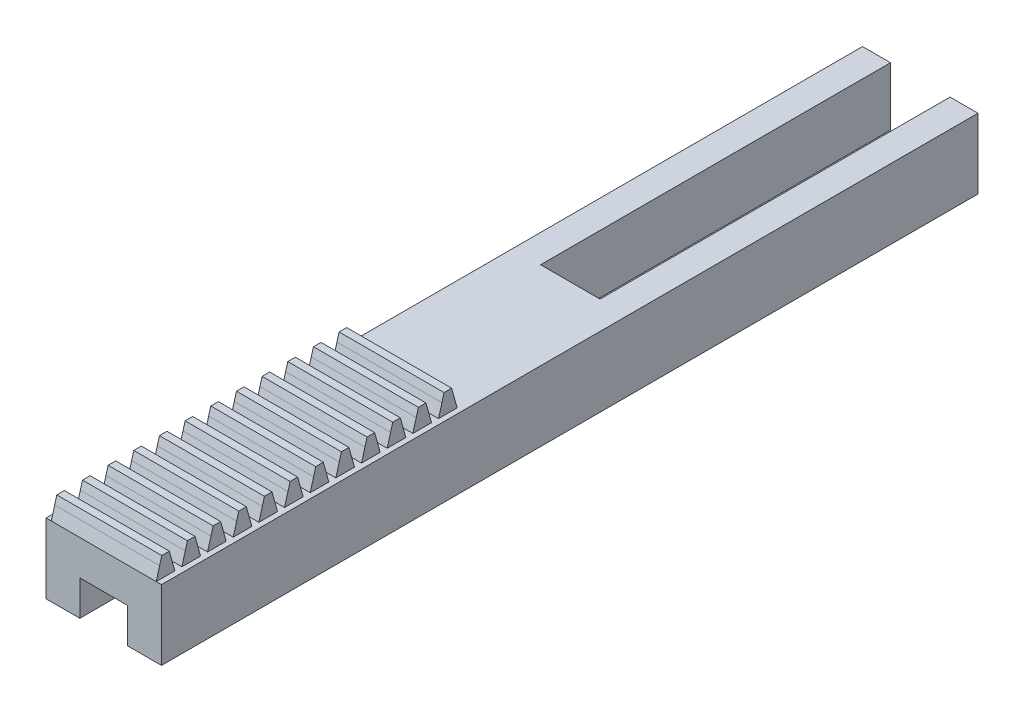
from build123d import *

# Parameters (mm, degrees)
EXTRUDE_2_DEPTH        = 4.95
EXTRUDE_3_DEPTH        = 4.5
PATTERN_LINEAR_1_COUNT = 12
PATTERN_LINEAR_1_PITCH = 2.2
SKETCH_7_W             = 5.1
SKETCH_7_H             = 30
CUT_EXTRUDE_1_DEPTH    = 5
SKETCH_3_W             = 35
SKETCH_3_H             = 3
CUT_EXTRUDE_2_DEPTH    = 2.05


with BuildPart() as part:
    # 스케치2 → 보스-돌출2 (new, symmetric)
    with BuildSketch(Plane(origin=(0, 0, 0), x_dir=(0, 0, -1), z_dir=(1, 0, 0))):
        Polygon((0, 6), (0, 0), (70, 0), (70, 6), (1.6, 6), align=None)
    extrude(amount=EXTRUDE_2_DEPTH, both=True)

    # 스케치2<4> → 보스-돌출3 (add, symmetric)
    with BuildSketch(Plane(origin=(0, 0, 0), x_dir=(0, 0, -1), z_dir=(1, 0, 0))):
        Polygon((0.291798614, 7.03781361), (0, 6), (1.6, 6), (1.308201386, 7.03781361), (1.125, 7.7), (0.475, 7.7), align=None)
    extrude_3 = extrude(amount=EXTRUDE_3_DEPTH, both=True)

    # 선형 패턴1: 보스-돌출3 ×12
    with Locations(*[(0, 0, -i * PATTERN_LINEAR_1_PITCH) for i in range(1, PATTERN_LINEAR_1_COUNT)]):
        add(extrude_3)

    # 스케치7 → 컷-돌출1 (cut)
    with BuildSketch(Plane(origin=(0, 6, 0), x_dir=(1, 0, 0), z_dir=(0, 1, 0))):
        with Locations((0, 55)):
            Rectangle(SKETCH_7_W, SKETCH_7_H)
    extrude(amount=-CUT_EXTRUDE_1_DEPTH, mode=Mode.SUBTRACT)

    # 스케치3 → 컷-돌출2 (cut, symmetric)
    with BuildSketch(Plane(origin=(0, 0, 0), x_dir=(0, 0, -1), z_dir=(1, 0, 0))):
        with Locations((17.5, 1.5)):
            Rectangle(SKETCH_3_W, SKETCH_3_H)
    extrude(amount=CUT_EXTRUDE_2_DEPTH, both=True, mode=Mode.SUBTRACT)


solid = part.part
